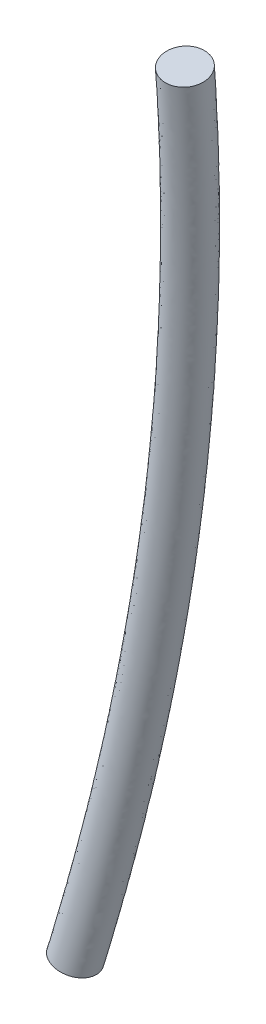
from build123d import *

# Parameters (mm, degrees)
SWEEP1_PROFILE_R = 3.175


with BuildPart() as part:
    # Sweep1: sweep along a curve in space
    with BuildLine() as sweep1_path:
        add(Edge.make_bspline(
            [(-19, -40.379280951, 237.3572), (-24.177539873, -106.750572168, 227.702786585), (-40.262729761, -170.657982601, 232.775044665)],
            knots=[0, 0, 0, 1, 1, 1], degree=2))
    # Sweep1 profile (on start of the path) → Sweep1 (sweep)
    with BuildSketch(Plane(origin=(-19, -40.379280951, 237.3572), x_dir=(0, 0.14394579441951494, -0.9895855740000128), z_dir=(-0.07696731605498296, -0.9866500835962143, -0.1435187959776544))):
        Circle(SWEEP1_PROFILE_R)
    sweep(path=sweep1_path.line)


solid = part.part
